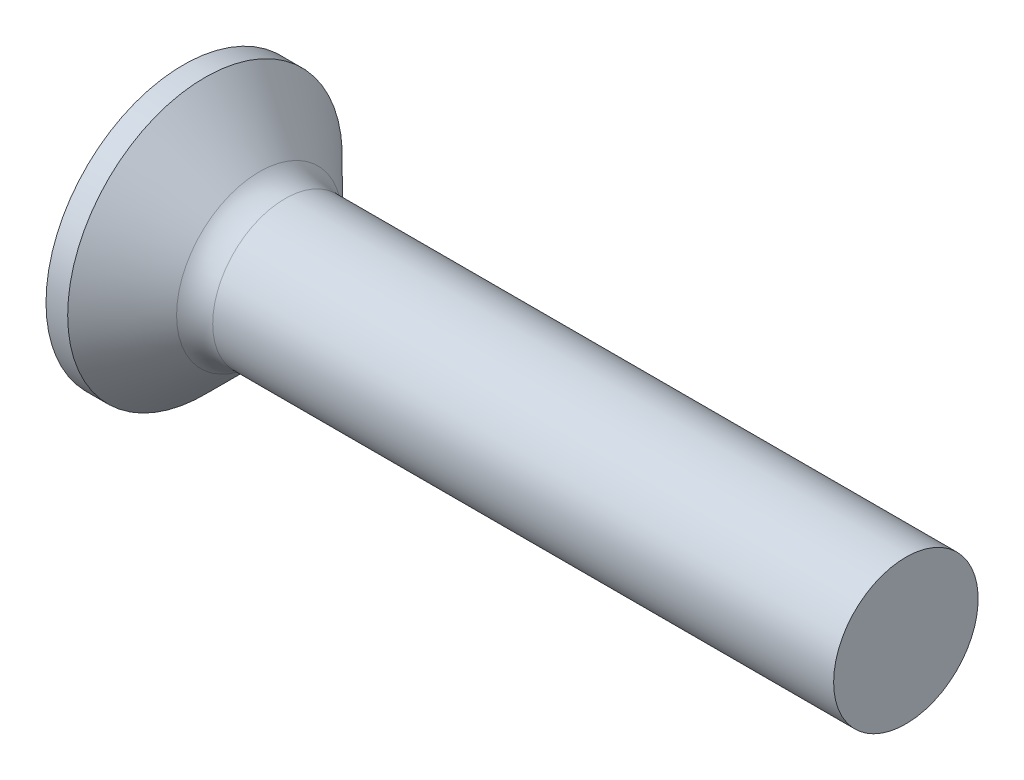
from build123d import *

# Parameters (mm, degrees)
FILLET1_R    = 0.5
RECPAT_COUNT = 2
RECPAT_ANGLE = 90


with BuildPart() as part:
    # BodySke → Base-Revolve (revolve)
    with BuildSketch(Plane.XY, mode=Mode.PRIVATE) as base_revolve_sk:
        with BuildLine():
            Line((0, 0), (10.5, 0))
            Line((10.5, 0), (10.5, 1))
            Line((10.5, 1), (1.7, 1))
            Line((1.7, 1), (0.8, 1.9))
            Line((0.8, 1.9), (0.5, 1.9))
            ThreePointArc((0.5, 1.9), (0.127092286, 0.982344135), (0, 0))
        make_face()
    revolve(base_revolve_sk.sketch.rotate(Axis((-15.875, 0, 0), (1, 0, 0)), 90), axis=Axis((-15.875, 0, 0), (1, 0, 0)))

    # Fillet1
    fillet1_edges = [part.edges().sort_by_distance(p)[0] for p in [
        (1.7, 0, -1),
    ]]
    fillet(fillet1_edges, radius=FILLET1_R)

    # Sketch3 → Recess section 0
    with BuildSketch(Plane(origin=(0, 0, 0), x_dir=(0, 0, -1), z_dir=(1, 0, 0))):
        with BuildLine():
            Line((0.24, -1.1), (-0.24, -1.1))
            Line((-0.24, -1.1), (-0.24, 1.1))
            Line((-0.24, 1.1), (0.24, 1.1))
            Line((0.24, 1.1), (0.24, -1.1))
        make_face()
    # Sketch4 → Recess section 1
    with BuildSketch(Plane(origin=(1.4, 0, 0), x_dir=(0, 0, -1), z_dir=(1, 0, 0))):
        with BuildLine():
            Line((0.24, -0.401985865), (-0.24, -0.401985865))
            Line((-0.24, -0.401985865), (-0.24, 0.401985865))
            Line((-0.24, 0.401985865), (0.24, 0.401985865))
            Line((0.24, 0.401985865), (0.24, -0.401985865))
        make_face()
    recess = loft(mode=Mode.SUBTRACT)

    # RecPat: Recess ×2 about axis
    recpat_axis = Axis((0, 0, 0), (1, 0, 0))
    for i in range(1, RECPAT_COUNT):
        add(recess.rotate(recpat_axis, i * RECPAT_ANGLE / (RECPAT_COUNT - 1)), mode=Mode.SUBTRACT)

    # RecCorSke → RecessCore (revolve, cut)
    with BuildSketch(Plane.XY, mode=Mode.PRIVATE) as recesscore_sk:
        Polygon((0, 0), (0, 0.453397537), (1.4, 0.3555), (1.515508952, 0), align=None)
    revolve(recesscore_sk.sketch.rotate(Axis((-3.175, 0, 0), (1, 0, 0)), 90), axis=Axis((-3.175, 0, 0), (1, 0, 0)), mode=Mode.SUBTRACT)


solid = part.part
